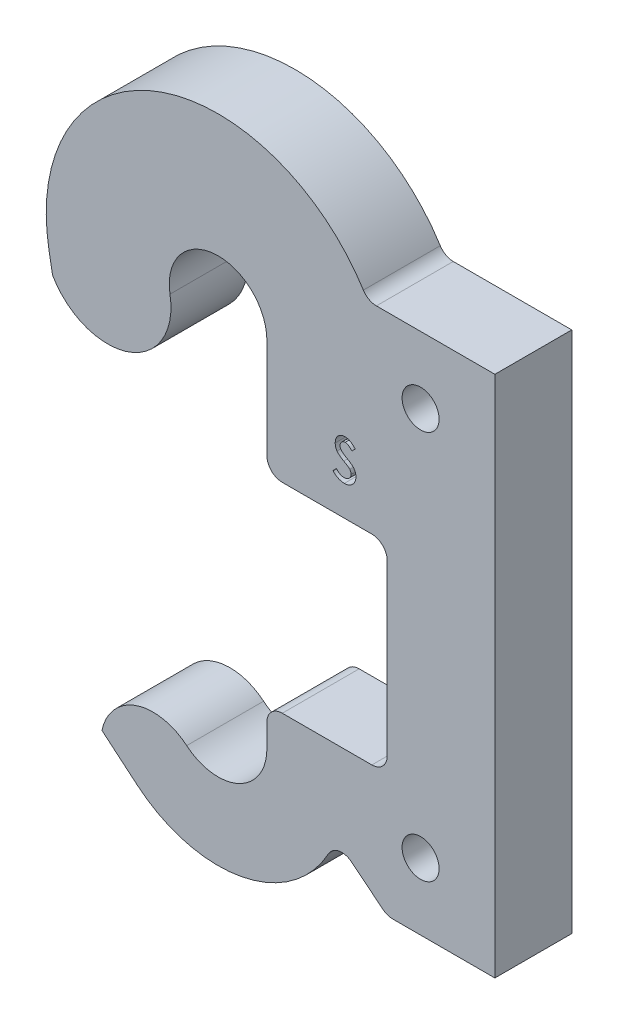
from build123d import *

# Parameters (mm, degrees)
CART_CLIP_DEPTH       = 5
HOLE_BLOCK_GEOMETRY_W = 7
HOLE_BLOCK_GEOMETRY_H = 34
HOLE_BLOCK_DEPTH      = 5
HOLE_GEOMETRY_R       = 1.205
HOLES_DEPTH           = 30.379510292
LPATTERN1_COUNT       = 2
LPATTERN1_PITCH       = 25.31
JOINT_DEPTH           = 5
NUT_SLOT_GEOMETRY_W   = 16
NUT_SLOT_GEOMETRY_H   = 13
NUT_SLOT_DEPTH        = 30.379510292
FILLET1_R             = 1
CUT_EXTRUDE1_DEPTH    = 10


with BuildPart() as part:
    # Cart Clip Geometry → Cart Clip (new body)
    with BuildSketch(Plane.XY):
        with BuildLine():
            Line((11.175, 10.5), (8.175, -10.5))
            Line((8.175, -10.5), (8.175, -11.5))
            ThreePointArc((8.175, -11.5), (3.45490429, -18.909066159), (-5.254788709, -17.762413322))
            Line((-5.254788709, -17.762413322), (-7.552922039, -15.834050493))
            ThreePointArc((-7.552922039, -15.834050493), (-5.335293593, -13.322679909), (-2.040850661, -13.932191107))
            ThreePointArc((-2.040850661, -13.932191107), (1.341812981, -14.377527224), (3.175, -11.5))
            Line((3.175, -11.5), (3.175, 11.5))
            ThreePointArc((3.175, 11.5), (-0.276719483, 14.662918166), (-3.126764616, 10.948667036))
            ThreePointArc((-3.126764616, 10.948667036), (-5.791346514, 6.35774359), (-10.766819067, 8.207405083))
            Line((-10.766819067, 8.207405083), (-11.00522664, 9.559481615))
            ThreePointArc((-11.00522664, 9.559481615), (-0.973965425, 22.632475751), (11.175, 11.5))
            Line((11.175, 11.5), (11.175, 10.5))
        make_face()
    extrude(amount=-CART_CLIP_DEPTH)



with BuildPart() as body_2:
    # hole block geometry → hole block (new body)
    with BuildSketch(Plane.XY):
        with Locations((14.5, 0)):
            Rectangle(HOLE_BLOCK_GEOMETRY_W, HOLE_BLOCK_GEOMETRY_H)
    extrude(amount=-HOLE_BLOCK_DEPTH)

    # hole geometry → holes (cut, through all)
    with BuildSketch(Plane.XY):
        with Locations((13.17, 12.655)):
            Circle(HOLE_GEOMETRY_R)
    holes = extrude(amount=-HOLES_DEPTH, mode=Mode.SUBTRACT)

    # LPattern1: holes ×2
    with Locations(*[(0, -i * LPATTERN1_PITCH, 0) for i in range(1, LPATTERN1_COUNT)]):
        add(holes, mode=Mode.SUBTRACT)


with BuildPart() as part_1:
    add(part.part)

    add(body_2.part)  # joint merges body 2
    # joint geometry → joint (add)
    with BuildSketch(Plane.XY):
        Polygon((9.727827352, 17), (11, 17), (11, -17), (7.674446724, -14.316645608), align=None)
    extrude(amount=-JOINT_DEPTH)

    # nut slot geometry → nut slot (cut, through all)
    with BuildSketch(Plane.XY):
        with Locations((3, -2.5)):
            Rectangle(NUT_SLOT_GEOMETRY_W, NUT_SLOT_GEOMETRY_H)
    extrude(amount=-NUT_SLOT_DEPTH, mode=Mode.SUBTRACT)

    # Fillet1
    fillet1_edges = [part_1.edges().sort_by_distance(p)[0] for p in [
        (7.674446724, -14.316645608, -2.5),
        (9.727827352, 17, -2.5),
        (11, -17, -2.5),
        (3.175, -9, -2.5),
        (3.175, 4, -2.5),
        (11, -9, -2.5),
        (11, 4, -2.5),
    ]]
    fillet(fillet1_edges, radius=FILLET1_R)

    # swing marker → Cut-Extrude1 (cut)
    with BuildSketch(Plane.XY):
        with BuildLine():
            Line((8.917878982, 8.248581949), (8.704737956, 8.029130827))
            add(Edge.make_bspline(
                [(8.704737956, 8.029130827), (8.686347453, 8.050443974), (8.650892727, 8.091533211), (8.594661246, 8.146470277), (8.538637643, 8.192607216), (8.483588829, 8.231559475), (8.42813056, 8.261008622), (8.372913642, 8.282503484), (8.317880903, 8.295805289), (8.281094868, 8.297519728), (8.263031226, 8.298361596)],
                knots=[0, 0, 0, 0, 1.26578478, 2.440284043, 3.530471711, 4.527705817, 5.468200915, 6.346673037, 7.188140097, 8, 8, 8, 8], degree=3))
            add(Edge.make_bspline(
                [(8.263031226, 8.298361596), (8.240891836, 8.297286724), (8.19732465, 8.295171526), (8.134898832, 8.274058095), (8.076948207, 8.241649357), (8.026791227, 8.195680773), (7.984303546, 8.142916504), (7.953289865, 8.08392018), (7.934323882, 8.020472136), (7.93191915, 7.976442278), (7.930699495, 7.954110795)],
                knots=[0, 0, 0, 0, 0.99966794, 1.967205029, 2.953328237, 3.988086729, 5.028030931, 6.008226631, 6.989793394, 8, 8, 8, 8], degree=3))
            add(Edge.make_bspline(
                [(7.930699495, 7.954110795), (7.931810307, 7.933898751), (7.9340288, 7.89353164), (7.95127548, 7.833983606), (7.978741552, 7.775926568), (8.004411746, 7.740363662), (8.017638597, 7.722039481)],
                knots=[0, 0, 0, 0, 0.960159726, 1.917612774, 2.927026955, 4, 4, 4, 4], degree=3))
            add(Edge.make_bspline(
                [(8.017638597, 7.722039481), (8.025602091, 7.712254897), (8.042551384, 7.691429642), (8.074359899, 7.662525789), (8.110382402, 7.630583538), (8.15370234, 7.598646701), (8.202453367, 7.565014976), (8.257692652, 7.531012843), (8.317667157, 7.494048418), (8.360604463, 7.470603982), (8.382923053, 7.458417686)],
                knots=[0, 0, 0, 0, 0.66740084, 1.420478572, 2.27185888, 3.217733974, 4.268547843, 5.408967954, 6.65319498, 8, 8, 8, 8], degree=3))
            add(Edge.make_bspline(
                [(8.382923053, 7.458417686), (8.41013663, 7.443172783), (8.4627043, 7.413724651), (8.537397067, 7.368014948), (8.605184108, 7.322583523), (8.666639776, 7.277916249), (8.720581584, 7.232763382), (8.768646137, 7.188855625), (8.809634581, 7.144866316), (8.832588508, 7.114133203), (8.843560072, 7.099443327)],
                knots=[0, 0, 0, 0, 1.27191281, 2.456916733, 3.569705269, 4.599008579, 5.553216877, 6.436649441, 7.252746552, 8, 8, 8, 8], degree=3))
            add(Edge.make_bspline(
                [(8.843560072, 7.099443327), (8.861770599, 7.069777239), (8.898012929, 7.010736218), (8.936071195, 6.913517791), (8.95813147, 6.810407288), (8.96119369, 6.739875068), (8.962750777, 6.704010635)],
                knots=[0, 0, 0, 0, 0.995354457, 1.980940102, 2.973342416, 4, 4, 4, 4], degree=3))
            add(Edge.make_bspline(
                [(8.962750777, 6.704010635), (8.962031243, 6.678741489), (8.960613323, 6.628945876), (8.950755256, 6.555611046), (8.93380028, 6.485476488), (8.910706526, 6.417781204), (8.879522153, 6.353822264), (8.842974356, 6.291986015), (8.799099444, 6.233610084), (8.749008069, 6.178771124), (8.694162575, 6.128685377), (8.635656436, 6.084661423), (8.573417606, 6.048087086), (8.507890804, 6.01782174), (8.43892715, 5.993753482), (8.366515861, 5.977090951), (8.290887106, 5.96711819), (8.239457298, 5.965733714), (8.213251578, 5.965028263)],
                knots=[0, 0, 0, 0, 1.032770009, 2.035186124, 3.017557409, 3.978232242, 4.952395191, 5.920591857, 6.910227898, 7.931268572, 8.952309245, 9.941945286, 10.918353717, 11.897095711, 12.887975737, 13.898235213, 14.929059601, 16, 16, 16, 16], degree=3))
            add(Edge.make_bspline(
                [(8.213251578, 5.965028263), (8.177884403, 5.966020963), (8.107641476, 5.967992571), (8.003751757, 5.986498632), (7.902230998, 6.015294026), (7.803847458, 6.05500996), (7.710801344, 6.105160673), (7.625670419, 6.165223066), (7.548158957, 6.233213064), (7.504040683, 6.285325974), (7.481981546, 6.31138243)],
                knots=[0, 0, 0, 0, 1.013940152, 2.01379169, 3.017749504, 4.037548394, 5.051665909, 6.043208538, 7.021604269, 8, 8, 8, 8], degree=3))
            Line((7.481981546, 6.31138243), (7.690214719, 6.548361596))
            add(Edge.make_bspline(
                [(7.690214719, 6.548361596), (7.709987132, 6.527006832), (7.748318944, 6.485607392), (7.809620161, 6.430483051), (7.871999562, 6.38428178), (7.934834249, 6.345638365), (7.999054343, 6.315862962), (8.064299957, 6.294944368), (8.130438382, 6.281500176), (8.174860517, 6.279921894), (8.197125777, 6.279130827)],
                knots=[0, 0, 0, 0, 1.179806542, 2.287233372, 3.337373186, 4.324005949, 5.273901747, 6.200048787, 7.097828587, 8, 8, 8, 8], degree=3))
            add(Edge.make_bspline(
                [(8.197125777, 6.279130827), (8.227443703, 6.280501652), (8.286679844, 6.283180014), (8.371523603, 6.307497106), (8.44986223, 6.345627058), (8.517885575, 6.399711756), (8.575787736, 6.462667329), (8.617715911, 6.533581448), (8.643992086, 6.610372905), (8.647078085, 6.663605207), (8.648648213, 6.690689321)],
                knots=[0, 0, 0, 0, 1.072336372, 2.095165389, 3.102688358, 4.141489647, 5.156069229, 6.117746104, 7.042326257, 8, 8, 8, 8], degree=3))
            add(Edge.make_bspline(
                [(8.648648213, 6.690689321), (8.647561918, 6.71299894), (8.645417176, 6.757046295), (8.628573904, 6.820796636), (8.601961051, 6.881265917), (8.575756403, 6.916655564), (8.562410232, 6.934679705)],
                knots=[0, 0, 0, 0, 1.013901739, 2.00181326, 2.98231254, 4, 4, 4, 4], degree=3))
            add(Edge.make_bspline(
                [(8.562410232, 6.934679705), (8.554387838, 6.943715068), (8.536912165, 6.96339735), (8.504856924, 6.991822428), (8.466475062, 7.022460528), (8.421334899, 7.054792117), (8.369345437, 7.088390722), (8.310295961, 7.123080074), (8.244995409, 7.1605078), (8.198824778, 7.185327455), (8.17468988, 7.1983015)],
                knots=[0, 0, 0, 0, 0.615000592, 1.339693406, 2.178160186, 3.116406724, 4.166410947, 5.330106347, 6.604359322, 8, 8, 8, 8], degree=3))
            add(Edge.make_bspline(
                [(8.17468988, 7.1983015), (8.148643239, 7.212840632), (8.098130492, 7.241036648), (8.026583201, 7.284952729), (7.962035847, 7.329620003), (7.902935272, 7.372532842), (7.850774267, 7.415953786), (7.805758318, 7.459931038), (7.766115102, 7.502691024), (7.744167691, 7.532988321), (7.733684271, 7.547460154)],
                knots=[0, 0, 0, 0, 1.262093308, 2.447601706, 3.550203992, 4.582594899, 5.537233252, 6.418365656, 7.244515135, 8, 8, 8, 8], degree=3))
            add(Edge.make_bspline(
                [(7.733684271, 7.547460154), (7.715553671, 7.576605769), (7.679286136, 7.634907184), (7.644070944, 7.732217661), (7.619864916, 7.834662719), (7.617702525, 7.905349573), (7.616596931, 7.941490603)],
                knots=[0, 0, 0, 0, 0.985009483, 1.970363186, 2.962279964, 4, 4, 4, 4], degree=3))
            add(Edge.make_bspline(
                [(7.616596931, 7.941490603), (7.617131126, 7.965116001), (7.618176622, 8.011354252), (7.626520674, 8.079293072), (7.641712385, 8.143841226), (7.660767307, 8.205968089), (7.687250312, 8.264470183), (7.718896217, 8.320127654), (7.756083642, 8.372863572), (7.798926933, 8.421866704), (7.846033578, 8.46637603), (7.896928348, 8.505174658), (7.950466604, 8.538281013), (8.006875024, 8.566046174), (8.066695497, 8.587047556), (8.129509883, 8.601504941), (8.195191038, 8.611160144), (8.240092164, 8.612023229), (8.263031226, 8.612464161)],
                knots=[0, 0, 0, 0, 1.087655834, 2.128696564, 3.144119009, 4.137814668, 5.115653402, 6.093965665, 7.082169637, 8.081268856, 9.086088321, 10.061021666, 11.022561449, 11.980240094, 12.950172527, 13.934149372, 14.944599409, 16, 16, 16, 16], degree=3))
            add(Edge.make_bspline(
                [(8.263031226, 8.612464161), (8.290223289, 8.61135982), (8.345117511, 8.609130422), (8.427472137, 8.591424732), (8.509705479, 8.562291628), (8.592028829, 8.522055394), (8.673839118, 8.469988518), (8.755855975, 8.407059219), (8.839064005, 8.333681504), (8.891020318, 8.277582279), (8.917878982, 8.248581949)],
                knots=[0, 0, 0, 0, 0.845714091, 1.707292901, 2.609013841, 3.555613372, 4.552488639, 5.621697636, 6.770543573, 8, 8, 8, 8], degree=3))
        make_face()
    extrude(amount=-CUT_EXTRUDE1_DEPTH, mode=Mode.SUBTRACT)


solid = part_1.part
